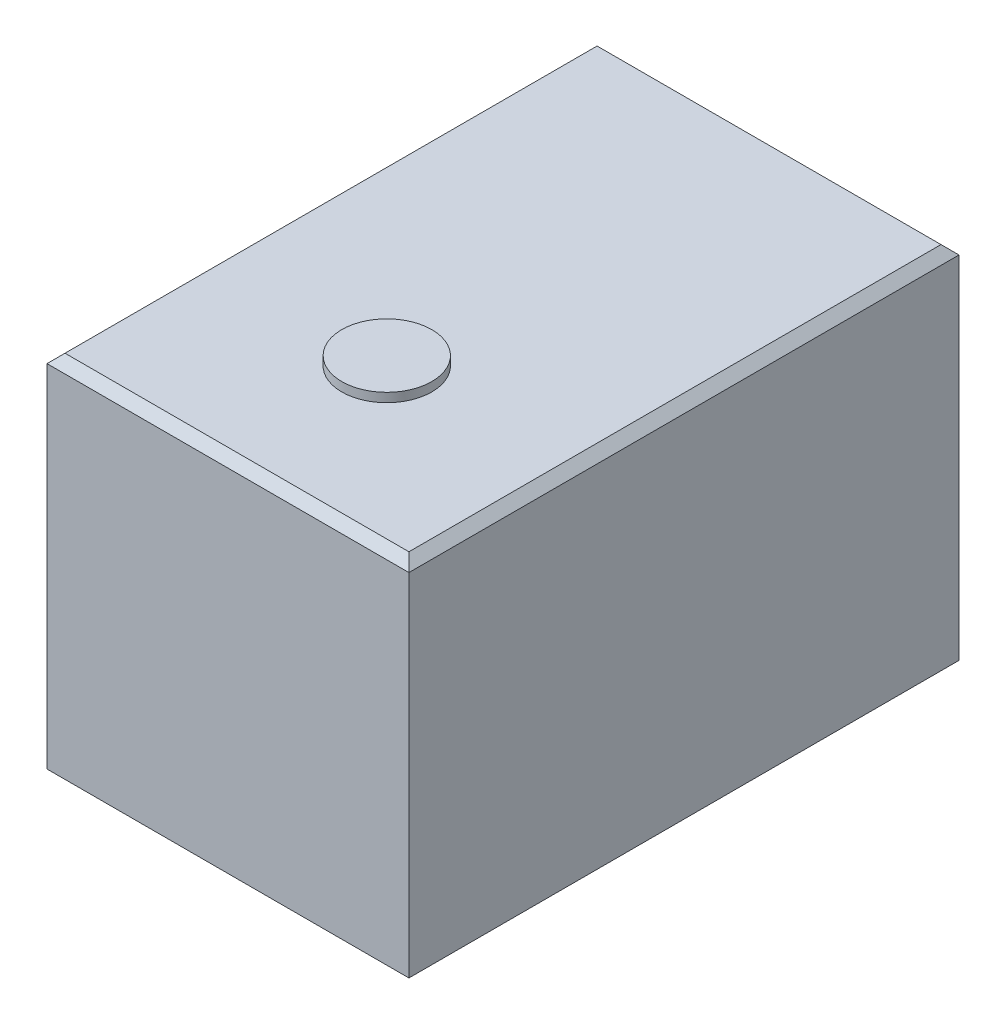
from build123d import *

# Parameters (mm, degrees)
SKETCH1_W           = 40.2
SKETCH1_H           = 61.1
BOSS_EXTRUDE1_DEPTH = 41
CHAMFER1_SIZE       = 1
CHAMFER2_SIZE       = 1
SKETCH2_R           = 5
BOSS_EXTRUDE2_DEPTH = 1


with BuildPart() as part:
    # Sketch1 → Boss-Extrude1 (new body)
    with BuildSketch(Plane(origin=(0, 0, 0), x_dir=(1, 0, 0), z_dir=(0, 1, 0))):
        with Locations((20.1, 30.55)):
            Rectangle(SKETCH1_W, SKETCH1_H)
    extrude(amount=BOSS_EXTRUDE1_DEPTH)

    # Chamfer1
    chamfer1_edges = [part.edges().sort_by_distance(p)[0] for p in [
        (40.2, 41, -30.55),
        (20.1, 41, -61.1),
        (0, 41, -30.55),
        (20.1, 41, 0),
    ]]
    chamfer(chamfer1_edges, length=CHAMFER1_SIZE)

    # Chamfer2
    chamfer2_edges = [part.edges().sort_by_distance(p)[0] for p in [
        (20.1, 0, -61.1),
        (40.2, 0, -30.55),
        (20.1, 0, 0),
        (0, 0, -30.55),
    ]]
    chamfer(chamfer2_edges, length=CHAMFER2_SIZE)

    # Sketch2 → Boss-Extrude2 (add)
    with BuildSketch(Plane.XZ):
        with Locations(Location((20.1, -17.640972678, 0), (0, 0, 90))):
            Circle(SKETCH2_R)
    boss_extrude2 = extrude(amount=BOSS_EXTRUDE2_DEPTH)

    # Mirror1: Boss-Extrude2 across plane
    add(boss_extrude2.mirror(Plane.ZX.offset(20.5)))


solid = part.part
